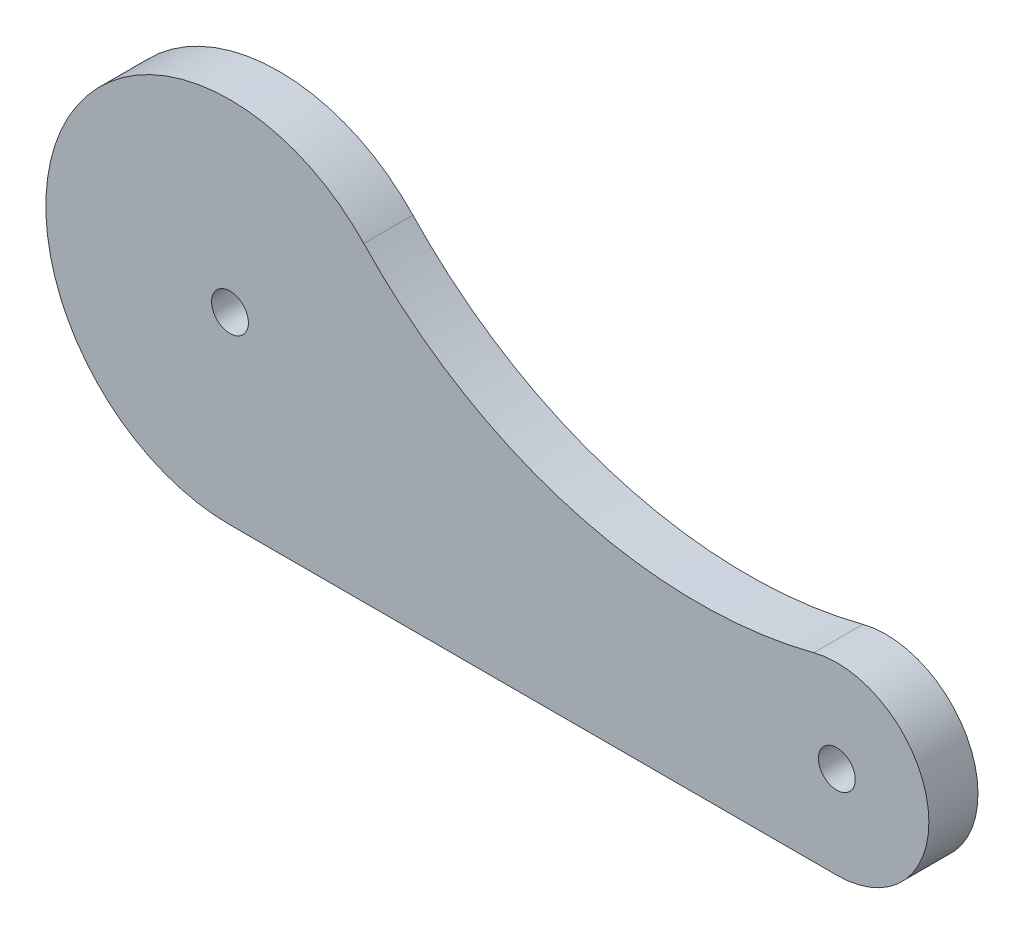
from build123d import *

# Parameters (mm, degrees)
SCHIZZO1_R                   = 1.5
ESTRUSIONE_ESTRUSIONE1_DEPTH = 4


with BuildPart() as part:
    # Schizzo1 → Estrusione-Estrusione1 (new body)
    with BuildSketch(Plane.XY):
        with BuildLine():
            Line((0, -15), (49.434299833, -15))
            ThreePointArc((49.434299833, -15), (56.874189574, -6.552349937), (47.554189972, -0.239477504))
            ThreePointArc((47.554189972, -0.239477504), (27.787162994, 0.02445935), (10.90104019, 10.30375285))
            ThreePointArc((10.90104019, 10.30375285), (-13.775998925, 5.934800218), (0, -15))
        make_face()
        Circle(SCHIZZO1_R, mode=Mode.SUBTRACT)
        with Locations((49.434299833, -7.5)):
            Circle(SCHIZZO1_R, mode=Mode.SUBTRACT)
    extrude(amount=ESTRUSIONE_ESTRUSIONE1_DEPTH)


solid = part.part
